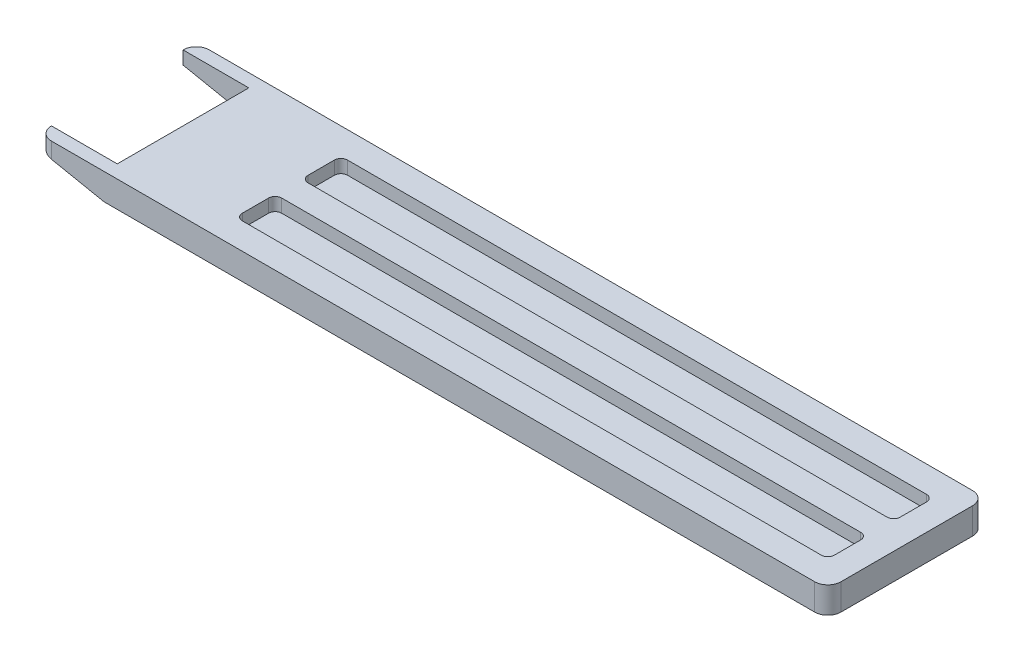
from build123d import *

# Parameters (mm, degrees)
SKETCH1_W           = 600
SKETCH1_H           = 120
BOSS_EXTRUDE1_DEPTH = 20
CUT_EXTRUDE1_REACH  = 325.728
SKETCH6_W           = 450
SKETCH6_H           = 30
CUT_EXTRUDE2_DEPTH  = 10
FILLET1_R           = 10
FILLET2_R           = 5
CUT_EXTRUDE3_REACH  = 308.594
SKETCH7_W           = 50
SKETCH7_H           = 100


with BuildPart() as part:
    # Sketch1 → Boss-Extrude1 (new body)
    with BuildSketch(Plane(origin=(0, 0, 0), x_dir=(1, 0, 0), z_dir=(0, 1, 0))):
        Rectangle(SKETCH1_W, SKETCH1_H)
    extrude(amount=BOSS_EXTRUDE1_DEPTH)

    # Sketch4 → Cut-Extrude1 (cut, up to next)
    with BuildSketch(Plane.XY.offset(60), mode=Mode.PRIVATE) as cut_extrude1_sk1:
        Polygon((-300, 10), (-250, 0), (-300, 0), align=None)
    cut_extrude1_tool1 = extrude(cut_extrude1_sk1.sketch, amount=-CUT_EXTRUDE1_REACH, mode=Mode.PRIVATE) & part.part
    add(cut_extrude1_tool1.solids().sort_by_distance((-283.333333, 3.333333, 60))[0], mode=Mode.SUBTRACT)

    # Sketch6 → Cut-Extrude2 (cut)
    with BuildSketch(Plane(origin=(0, 20, 0), x_dir=(1, 0, 0), z_dir=(0, 1, 0))):
        with Locations((55, 25)):
            Rectangle(SKETCH6_W, SKETCH6_H)
        with Locations((55, -25)):
            Rectangle(SKETCH6_W, SKETCH6_H)
    extrude(amount=-CUT_EXTRUDE2_DEPTH, mode=Mode.SUBTRACT)

    # Fillet1
    fillet1_edges = [part.edges().sort_by_distance(p)[0] for p in [
        (-300, 15, -60),
        (300, 10, -60),
        (300, 10, 60),
        (-300, 15, 60),
    ]]
    fillet(fillet1_edges, radius=FILLET1_R)

    # Fillet2
    fillet2_edges = [part.edges().sort_by_distance(p)[0] for p in [
        (-170, 15, -10),
        (-170, 15, -40),
        (280, 15, -40),
        (280, 15, -10),
        (-170, 15, 40),
        (-170, 15, 10),
        (280, 15, 10),
        (280, 15, 40),
    ]]
    fillet(fillet2_edges, radius=FILLET2_R)

    # Sketch7 → Cut-Extrude3 (cut, up to next)
    with BuildSketch(Plane(origin=(0, 20, 0), x_dir=(1, 0, 0), z_dir=(0, 1, 0)), mode=Mode.PRIVATE) as cut_extrude3_sk1:
        with Locations((-275, 0)):
            Rectangle(SKETCH7_W, SKETCH7_H)
    cut_extrude3_tool1 = extrude(cut_extrude3_sk1.sketch, amount=-CUT_EXTRUDE3_REACH, mode=Mode.PRIVATE) & part.part
    add(cut_extrude3_tool1.solids().sort_by_distance((-275, 20, 0))[0], mode=Mode.SUBTRACT)


solid = part.part
